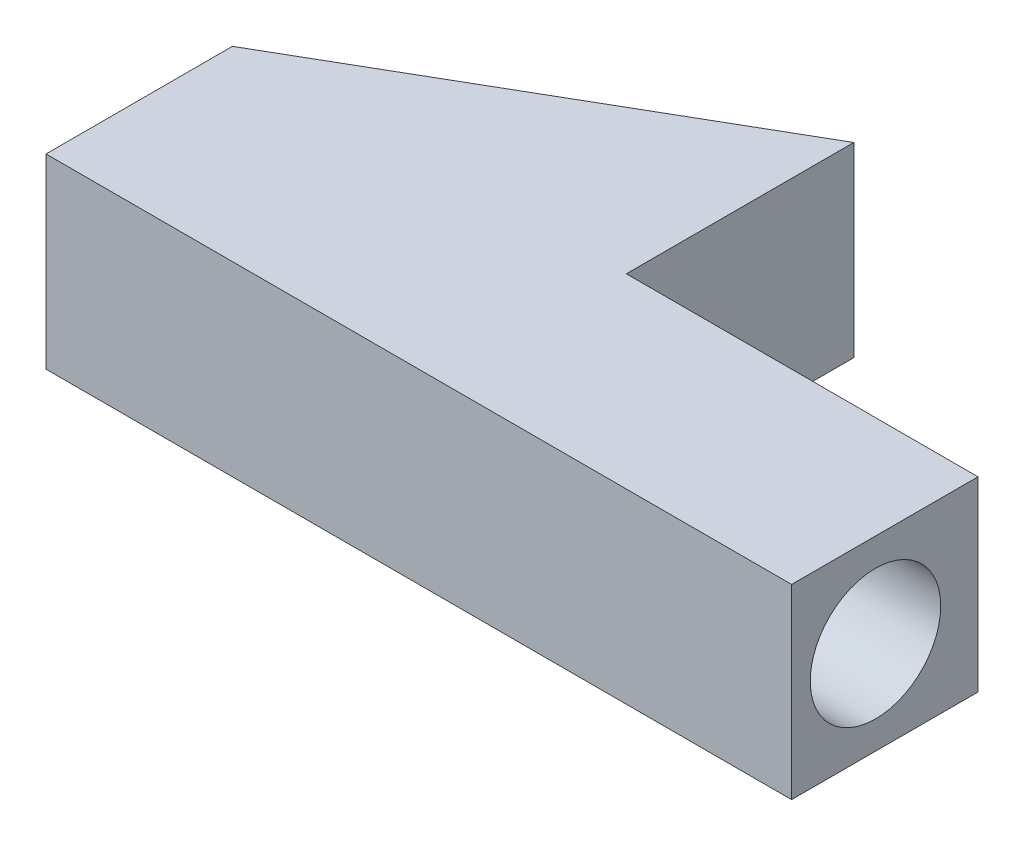
from build123d import *

# Parameters (mm, degrees)
BOSS_EXTRUDE1_DEPTH = 5
SKETCH2_R           = 1.5
CUT_EXTRUDE1_DEPTH  = 5
SKETCH5_W           = 20
SKETCH5_H           = 5
BOSS_EXTRUDE3_DEPTH = 2
CUT_EXTRUDE2_REACH  = 24.535
SKETCH6_R           = 1.75


with BuildPart() as part:
    # Sketch1 → Boss-Extrude1 (new body)
    with BuildSketch(Plane(origin=(0, 0, 0), x_dir=(1, 0, 0), z_dir=(0, 1, 0))):
        Polygon((0, 0), (0, 3), (10.567063084, 9.100896716), (10.567063084, 3), (20, 3), (20, 0), align=None)
    extrude(amount=BOSS_EXTRUDE1_DEPTH)

    # Sketch2 → Cut-Extrude1 (cut)
    with BuildSketch(Plane(origin=(-1.299038106, 0, -2.25), x_dir=(-0.8660254037844397, 0, 0.49999999999999806), z_dir=(-0.49999999999999806, 0, -0.8660254037844397))):
        with Locations((-7.5, 2.5)):
            Circle(SKETCH2_R)
    extrude(amount=-CUT_EXTRUDE1_DEPTH, mode=Mode.SUBTRACT)

    # Sketch5 → Boss-Extrude3 (add)
    with BuildSketch(Plane.XY):
        with Locations((10, 2.5)):
            Rectangle(SKETCH5_W, SKETCH5_H)
    extrude(amount=BOSS_EXTRUDE3_DEPTH)

    # Cut-Extrude2: up to this face of the body (flat: up to its plane)
    cut_extrude2_end = Plane(part.part.faces().sort_by_distance((0, 2.5, -0.5))[0])
    # Sketch6 → Cut-Extrude2 (cut, up to the picked face)
    with BuildSketch(Plane(origin=(20, 0, 0), x_dir=(0, 0, -1), z_dir=(1, 0, 0)), mode=Mode.PRIVATE) as cut_extrude2_sk1:
        with Locations((0.25, 2.5)):
            Circle(SKETCH6_R)
    cut_extrude2_tool1 = split(extrude(cut_extrude2_sk1.sketch, amount=-CUT_EXTRUDE2_REACH, mode=Mode.PRIVATE), bisect_by=cut_extrude2_end, keep=Keep.BOTH, mode=Mode.PRIVATE)
    add(cut_extrude2_tool1.solids().sort_by(Axis((20, 2.5, -0.25), (-1, 0, 0)))[0], mode=Mode.SUBTRACT)


solid = part.part
